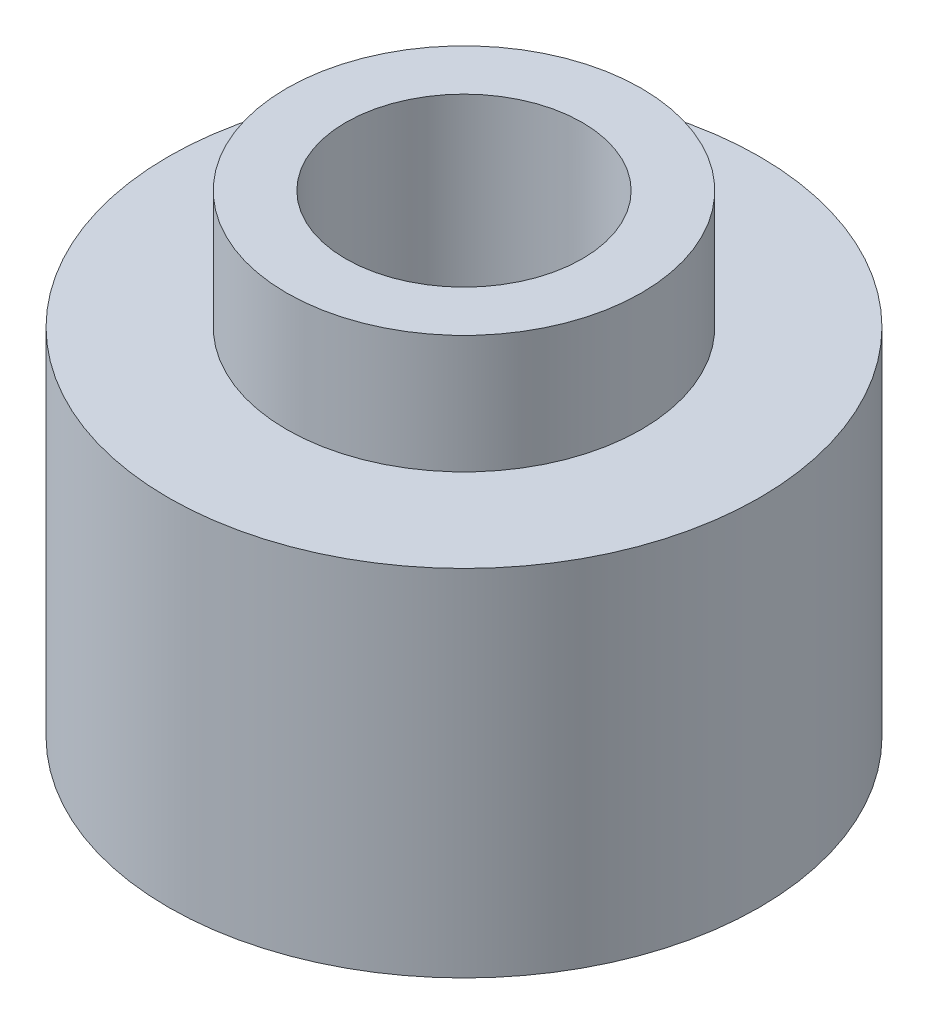
from build123d import *

# Parameters (mm, degrees)
SKETCH1_R                   = 7.9375
BOSS_EXTRUDE1_DEPTH         = 9.525
SKETCH2_R                   = 4.7625
BOSS_EXTRUDE2_DEPTH         = 3.175
F_1_4_0_25_DIAMETER_HOLE1_D = 6.35
F_10_32_TAPPED_HOLE1_REACH  = 23.825
F_10_32_TAPPED_HOLE1_BORE_R = 2.0193


with BuildPart() as part:
    # Sketch1 → Boss-Extrude1 (new body)
    with BuildSketch(Plane(origin=(0, 0, 0), x_dir=(1, 0, 0), z_dir=(0, 1, 0))):
        with Locations(Location((0, 0, 0), (0, 0, 90))):
            Circle(SKETCH1_R)
    extrude(amount=BOSS_EXTRUDE1_DEPTH)

    # Sketch2 → Boss-Extrude2 (add)
    with BuildSketch(Plane(origin=(0, 9.525, 0), x_dir=(1, 0, 0), z_dir=(0, 1, 0))):
        with Locations(Location((0, 0, 0), (0, 0, 270))):
            Circle(SKETCH2_R)
    extrude(amount=BOSS_EXTRUDE2_DEPTH)

    # 1/4 (0.25) Diameter Hole1 (through all)
    with Locations(Plane(origin=(0, 0, 0), x_dir=(-1, 0, 0), z_dir=(0, -1, 0))):
        with Locations((0, 0)):
            Hole(F_1_4_0_25_DIAMETER_HOLE1_D / 2)

    # #10-32 Tapped Hole1 bore → #10-32 Tapped Hole1 (cut, up to next)
    with BuildSketch(Plane(origin=(0, 0, -7.9375), x_dir=(-1, 0, 0), z_dir=(0, 0, -1)), mode=Mode.PRIVATE) as f_10_32_tapped_hole1_sk1:
        with Locations((0, 4.7625)):
            Circle(F_10_32_TAPPED_HOLE1_BORE_R)
    f_10_32_tapped_hole1_tool1 = extrude(f_10_32_tapped_hole1_sk1.sketch, amount=-F_10_32_TAPPED_HOLE1_REACH, mode=Mode.PRIVATE) & part.part
    add(f_10_32_tapped_hole1_tool1.solids().sort_by_distance((0, 4.7625, -7.9375))[0], mode=Mode.SUBTRACT)


solid = part.part
